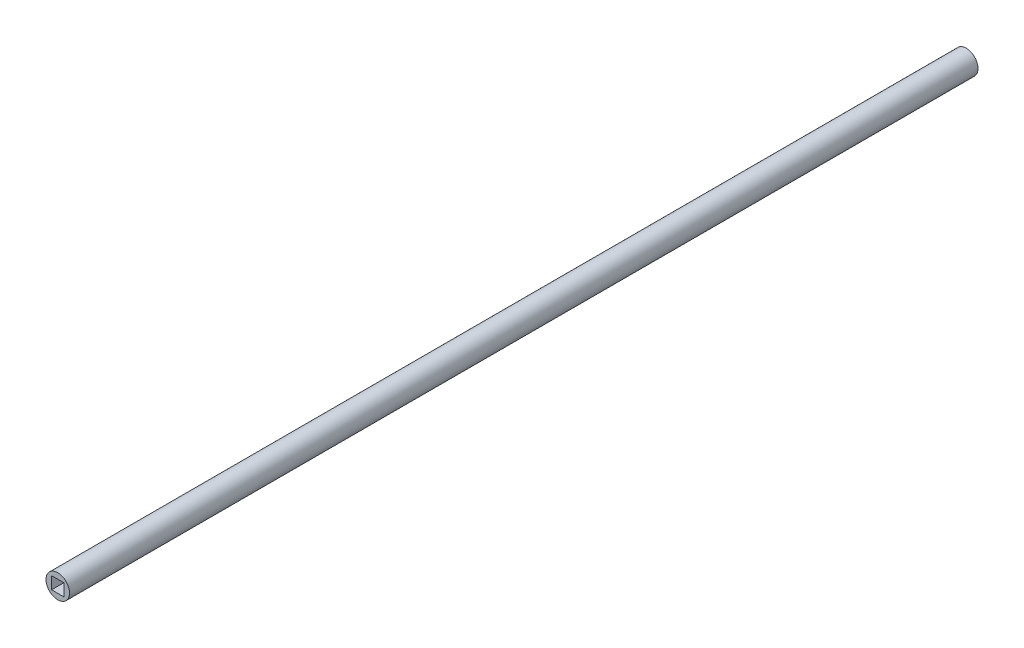
from build123d import *

# Parameters (mm, degrees)
SKETCH1_R           = 3.175
SKETCH1_W           = 3.302040176
SKETCH1_H           = 3.302040176
BOSS_EXTRUDE1_DEPTH = 245.360000008


with BuildPart() as part:
    # Sketch1 → Boss-Extrude1 (new body)
    with BuildSketch(Plane.XY):
        with Locations(Location((0, 0, 0), (0, 0, 180))):
            Circle(SKETCH1_R)
        Rectangle(SKETCH1_W, SKETCH1_H, mode=Mode.SUBTRACT)
    extrude(amount=BOSS_EXTRUDE1_DEPTH)


solid = part.part
